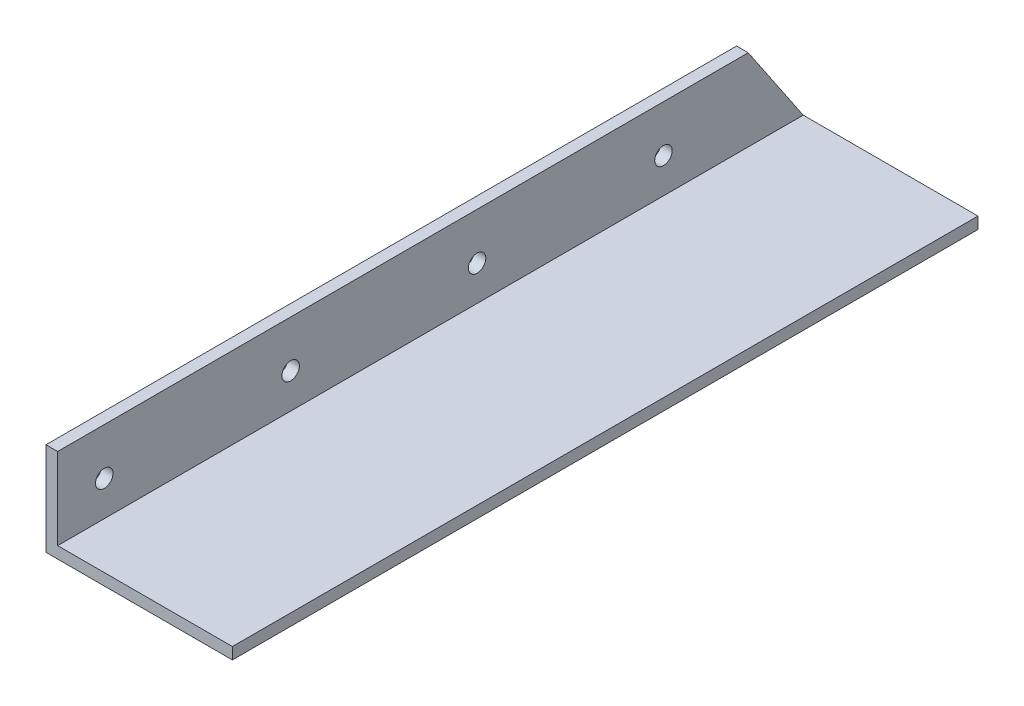
from build123d import *

# Parameters (mm, degrees)
BOSS_EXTRUDE1_DEPTH = 203.2
SKETCH2_R           = 2.38125
CUT_EXTRUDE1_DEPTH  = 211.988246118
CHAMFER4_SIZE       = 22.225
CHAMFER4_SIZE2      = 14.990951787


with BuildPart() as part:
    # Sketch1 → Boss-Extrude1 (new body)
    with BuildSketch(Plane.XY):
        Polygon((0, 25.4), (0, 0), (50.8, 0), (50.8, 3.175), (3.175, 3.175), (3.175, 25.4), align=None)
    extrude(amount=BOSS_EXTRUDE1_DEPTH)

    # Sketch2 → Cut-Extrude1 (cut, through all)
    with BuildSketch(Plane.ZY):
        with Locations((190.5, 12.7)):
            Circle(SKETCH2_R)
        with Locations((139.7, 12.7)):
            Circle(SKETCH2_R)
        with Locations((88.9, 12.7)):
            Circle(SKETCH2_R)
        with Locations((38.1, 12.7)):
            Circle(SKETCH2_R)
        with Locations((-12.7, 12.7)):
            Circle(SKETCH2_R)
    extrude(amount=-CUT_EXTRUDE1_DEPTH, mode=Mode.SUBTRACT)

    # Chamfer4
    chamfer4_edges = [part.edges().sort_by_distance(p)[0] for p in [
        (1.5875, 25.4, 0),
    ]]
    chamfer4_side = [part.faces().sort_by_distance(p)[0] for p in [
        (1.5875, 24.832038734, 0),
    ]]
    chamfer(chamfer4_edges, length=CHAMFER4_SIZE, length2=CHAMFER4_SIZE2, reference=chamfer4_side[0])


solid = part.part
